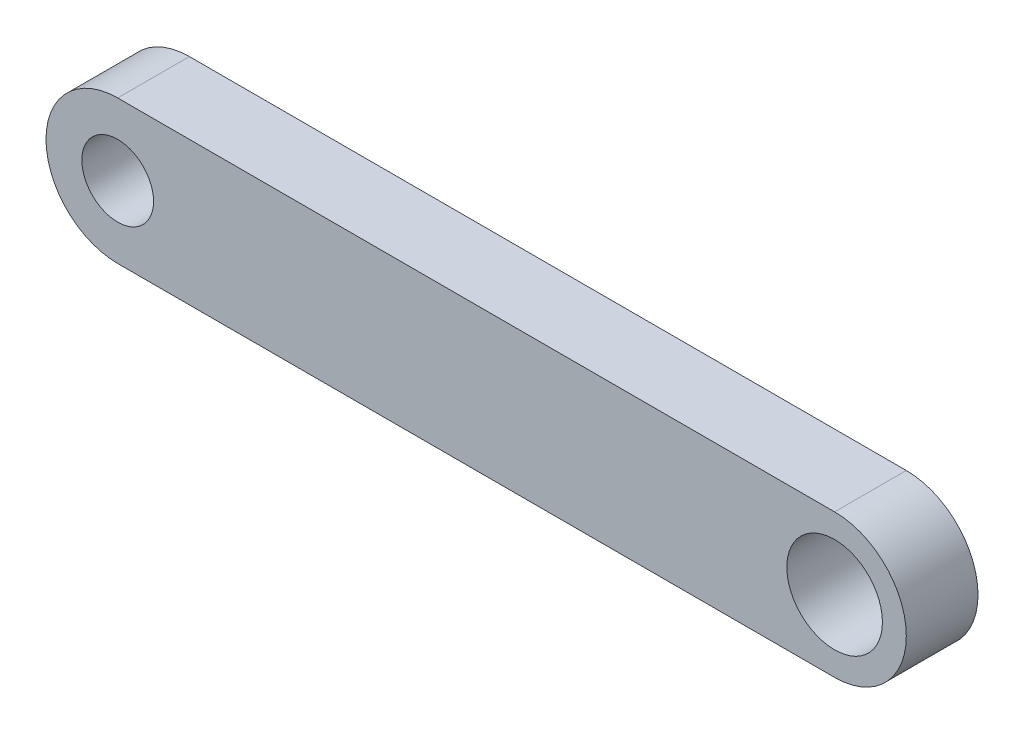
from build123d import *

# Parameters (mm, degrees)
SKETCH_1_R      = 15
SKETCH_1_R_2    = 20
EXTRUDE_1_DEPTH = 30


with BuildPart() as part:
    # 草图1 → 凸台-拉伸1 (new body)
    with BuildSketch(Plane.XY):
        with BuildLine():
            Line((-80.440466256, 30), (219.559533744, 30))
            ThreePointArc((219.559533744, 30), (249.559533744, 0), (219.559533744, -30))
            Line((219.559533744, -30), (-80.440466256, -30))
            ThreePointArc((-80.440466256, -30), (-110.440466256, 0), (-80.440466256, 30))
        make_face()
        with Locations((-80.440466256, 0)):
            Circle(SKETCH_1_R, mode=Mode.SUBTRACT)
        with Locations((219.559533744, 0)):
            Circle(SKETCH_1_R_2, mode=Mode.SUBTRACT)
    extrude(amount=EXTRUDE_1_DEPTH)


solid = part.part
